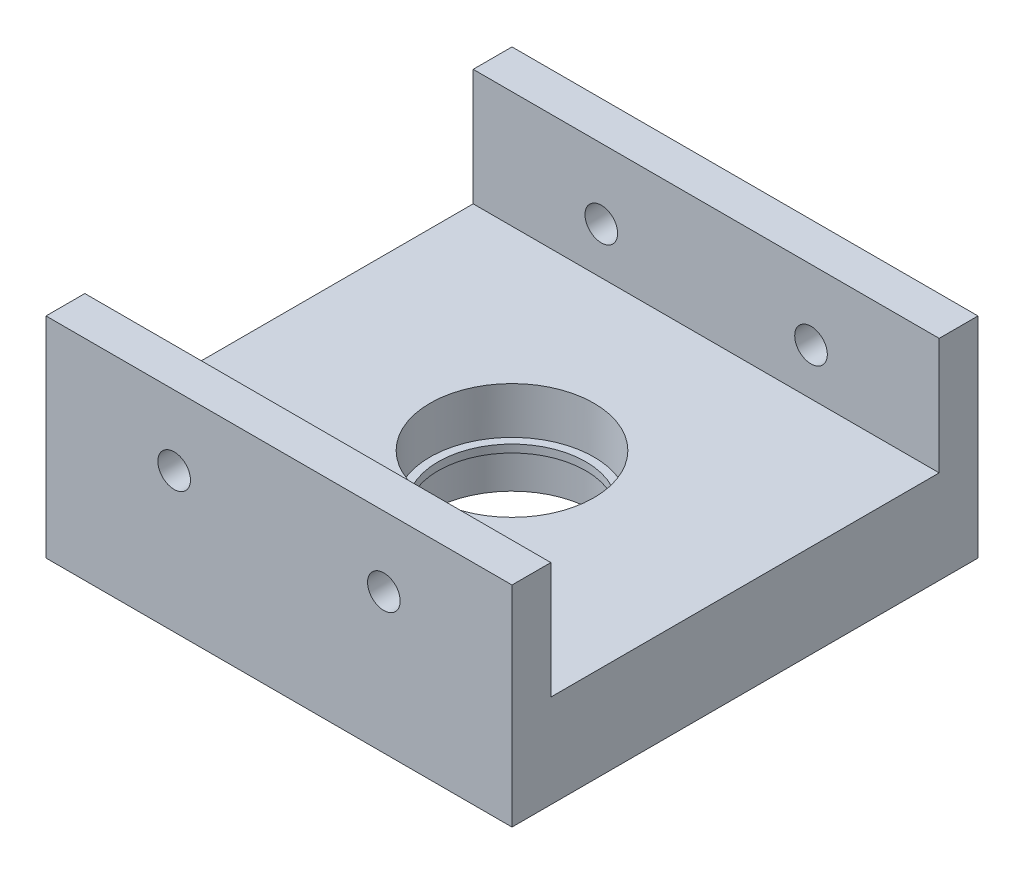
from build123d import *

# Parameters (mm, degrees)
SKETCH_1_W          = 60
SKETCH_1_H          = 60
SKETCH_1_R          = 9.5
EXTRUDE_1_DEPTH     = 12
SKETCH_3_R          = 10.55
CUT_EXTRUDE_1_DEPTH = 5
SKETCH_6_W          = 60
SKETCH_6_H          = 5
EXTRUDE_2_DEPTH     = 15
SKETCH_7_R          = 2.1
CUT_EXTRUDE_2_DEPTH = 73.311824759
SKETCH_8_R          = 10.55
CUT_EXTRUDE_3_DEPTH = 1


with BuildPart() as part:
    # 草图1 → 凸台-拉伸1 (new body)
    with BuildSketch(Plane(origin=(0, 0, 0), x_dir=(1, 0, 0), z_dir=(0, 1, 0))):
        Rectangle(SKETCH_1_W, SKETCH_1_H)
        with Locations(Location((0, 0, 0), (0, 0, 270))):
            Circle(SKETCH_1_R, mode=Mode.SUBTRACT)
    extrude(amount=EXTRUDE_1_DEPTH)

    # 草图3 → 切除-拉伸1 (cut)
    with BuildSketch(Plane.XZ):
        with Locations(Location((0, 0, 0), (0, 0, 270))):
            Circle(SKETCH_3_R)
    cut_extrude_1 = extrude(amount=-CUT_EXTRUDE_1_DEPTH, mode=Mode.SUBTRACT)

    # 镜向1: 切除-拉伸1 across plane
    add(cut_extrude_1.mirror(Plane(origin=(0, 6, 0), x_dir=(0, 0, 1), z_dir=(0, -1, 0))), mode=Mode.SUBTRACT)

    # 草图6 → 凸台-拉伸2 (add)
    with BuildSketch(Plane(origin=(0, 12, 0), x_dir=(1, 0, 0), z_dir=(0, 1, 0))):
        with Locations((0, 27.5)):
            Rectangle(SKETCH_6_W, SKETCH_6_H)
        with Locations((0, -27.5)):
            Rectangle(SKETCH_6_W, SKETCH_6_H)
    extrude(amount=EXTRUDE_2_DEPTH)

    # 草图7 → 切除-拉伸2 (cut, through all)
    with BuildSketch(Plane.XY.offset(30)):
        with Locations((-13.5, 18)):
            Circle(SKETCH_7_R)
        with Locations((13.5, 18)):
            Circle(SKETCH_7_R)
    extrude(amount=-CUT_EXTRUDE_2_DEPTH, mode=Mode.SUBTRACT)

    # 草图8 → 切除-拉伸3 (cut)
    with BuildSketch(Plane(origin=(0, 7, 0), x_dir=(1, 0, 0), z_dir=(0, 1, 0))):
        with Locations(Location((0, 0, 0), (0, 0, 90))):
            Circle(SKETCH_8_R)
    extrude(amount=-CUT_EXTRUDE_3_DEPTH, mode=Mode.SUBTRACT)


solid = part.part
